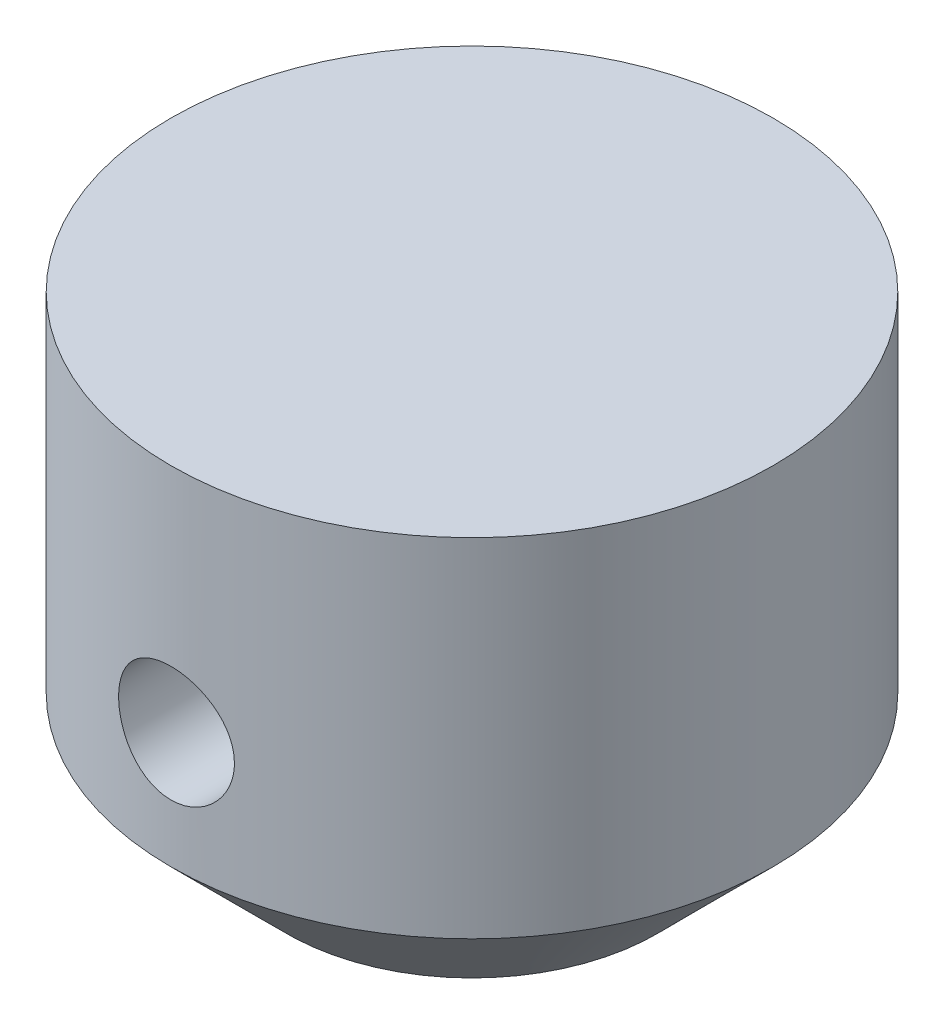
from build123d import *

# Parameters (mm, degrees)
SKETCH2_R         = 0.5
PASO_CUERDA_DEPTH = 1000


with BuildPart() as part:
    # Sketch1 → Cubo_salida (revolve)
    with BuildSketch(Plane.XY, mode=Mode.PRIVATE) as cubo_salida_sk:
        Polygon((0, -32), (2.6, -32), (2.6, -35), (1.6, -36), (0, -36), align=None)
    revolve(cubo_salida_sk.sketch.rotate(Axis((0, -40, 0), (0, 1, 0)), 90), axis=Axis((0, -40, 0), (0, 1, 0)))

    # Sketch2 → Paso_cuerda (cut, symmetric)
    with BuildSketch(Plane.XY):
        with Locations((0, -34)):
            Circle(SKETCH2_R)
    extrude(amount=PASO_CUERDA_DEPTH, both=True, mode=Mode.SUBTRACT)


solid = part.part
